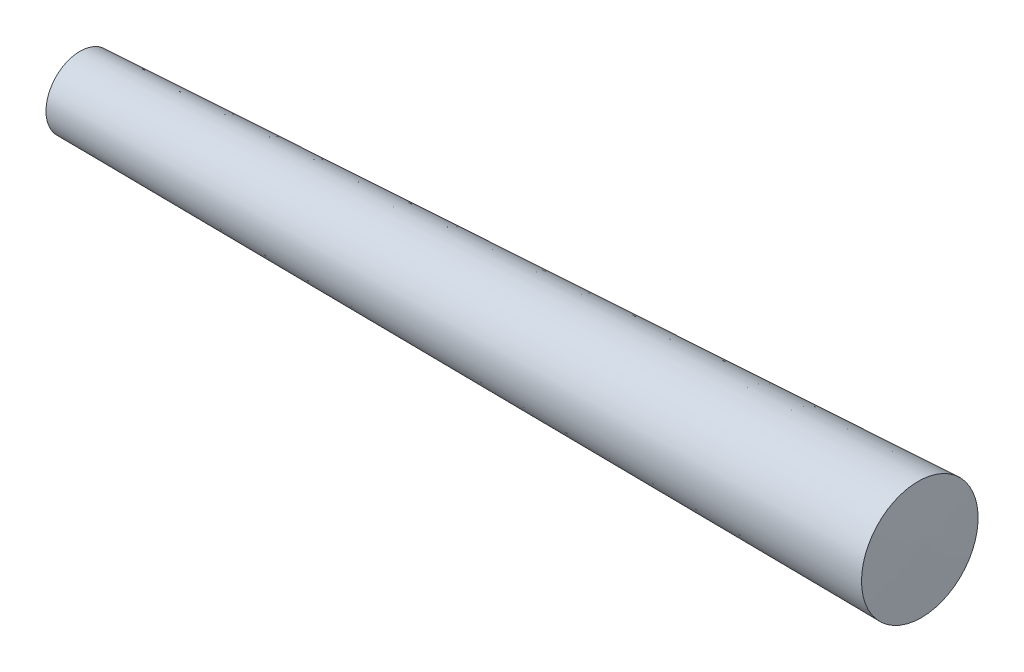
from build123d import *


with BuildPart() as part:
    # Sketch1 → Revolve1 (revolve)
    with BuildSketch(Plane.XY):
        Polygon((0, 0), (36, 0), (36, 2.5), (0, 1.5), align=None)
    revolve(axis=Axis((0, 1.5, 0), (0.9996144206527183, 0.02776706724035329, 0)))


solid = part.part
